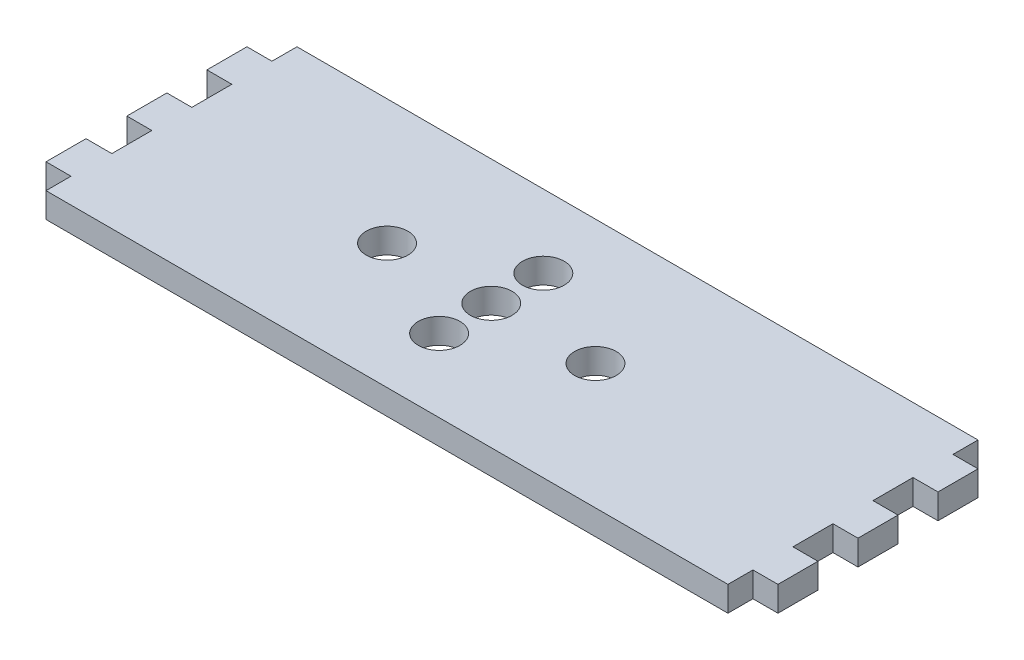
from build123d import *

# Parameters (mm, degrees)
ESBO_O1_R                = 2.5
ESBO_O1_R_2              = 2.499999997
ESBO_O1_R_3              = 2.500000003
RESSALTO_EXTRUS_O1_DEPTH = 3


with BuildPart() as part:
    # Esboço1 → Ressalto-extrusão1 (new body)
    with BuildSketch(Plane(origin=(0, 0, 0), x_dir=(1, 0, 0), z_dir=(0, 1, 0))):
        Polygon((-57.924923454, 7.893845864), (-54.924923454, 7.893845864), (-54.924923454, 10.893845864), (26.768392501, 10.893845864), (26.768392501, 7.893845864), (29.768392501, 7.893845864), (29.768392501, 3.093845864), (26.770408679, 3.093845864), (26.770408679, -1.706154136), (29.770408679, -1.706154136), (29.770408679, -6.506154136), (26.770408679, -6.506154136), (26.770408679, -11.306154136), (29.770408679, -11.306154136), (29.770408679, -16.105925898), (26.770408679, -16.105925898), (26.770408679, -19.105925898), (-55.029591321, -19.105925898), (-55.029591321, -16.105925898), (-58.029591321, -16.105925898), (-58.029591321, -11.306154136), (-54.931224008, -11.306154136), (-54.931224008, -6.506154136), (-57.931224008, -6.506154136), (-57.931224008, -1.706154136), (-54.934182698, -1.706154136), (-54.934182698, 3.093845864), (-57.924923454, 3.093845864), align=None)
        with Locations(Location((-16.621271344, -4.105925898, 0), (0, 0, 270))):
            Circle(ESBO_O1_R, mode=Mode.SUBTRACT)
        with Locations(Location((-16.621271344, 2.144074102, 0), (0, 0, 270))):
            Circle(ESBO_O1_R, mode=Mode.SUBTRACT)
        with Locations(Location((-4.121271344, -4.105925898, 0), (0, 0, 270))):
            Circle(ESBO_O1_R_2, mode=Mode.SUBTRACT)
        with Locations(Location((-16.621271344, -10.355925898, 0), (0, 0, 270))):
            Circle(ESBO_O1_R, mode=Mode.SUBTRACT)
        with Locations(Location((-29.121271344, -4.105925898, 0), (0, 0, 270))):
            Circle(ESBO_O1_R_3, mode=Mode.SUBTRACT)
    extrude(amount=RESSALTO_EXTRUS_O1_DEPTH)


solid = part.part
